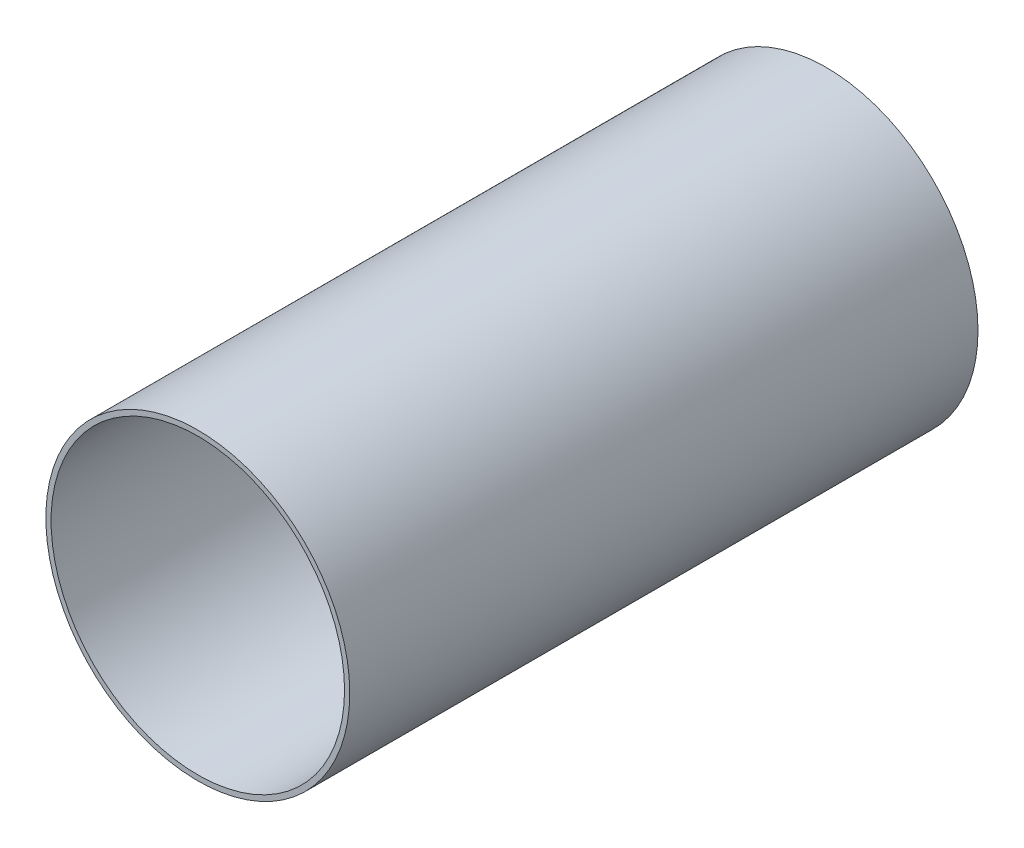
from build123d import *

# Parameters (mm, degrees)
SKETCH1_R           = 79
SKETCH1_R_2         = 76.29
BOSS_EXTRUDE1_DEPTH = 326.63


with BuildPart() as part:
    # Sketch1 → Boss-Extrude1 (new body)
    with BuildSketch(Plane.XY):
        Circle(SKETCH1_R)
        Circle(SKETCH1_R_2, mode=Mode.SUBTRACT)
    extrude(amount=BOSS_EXTRUDE1_DEPTH)


solid = part.part
